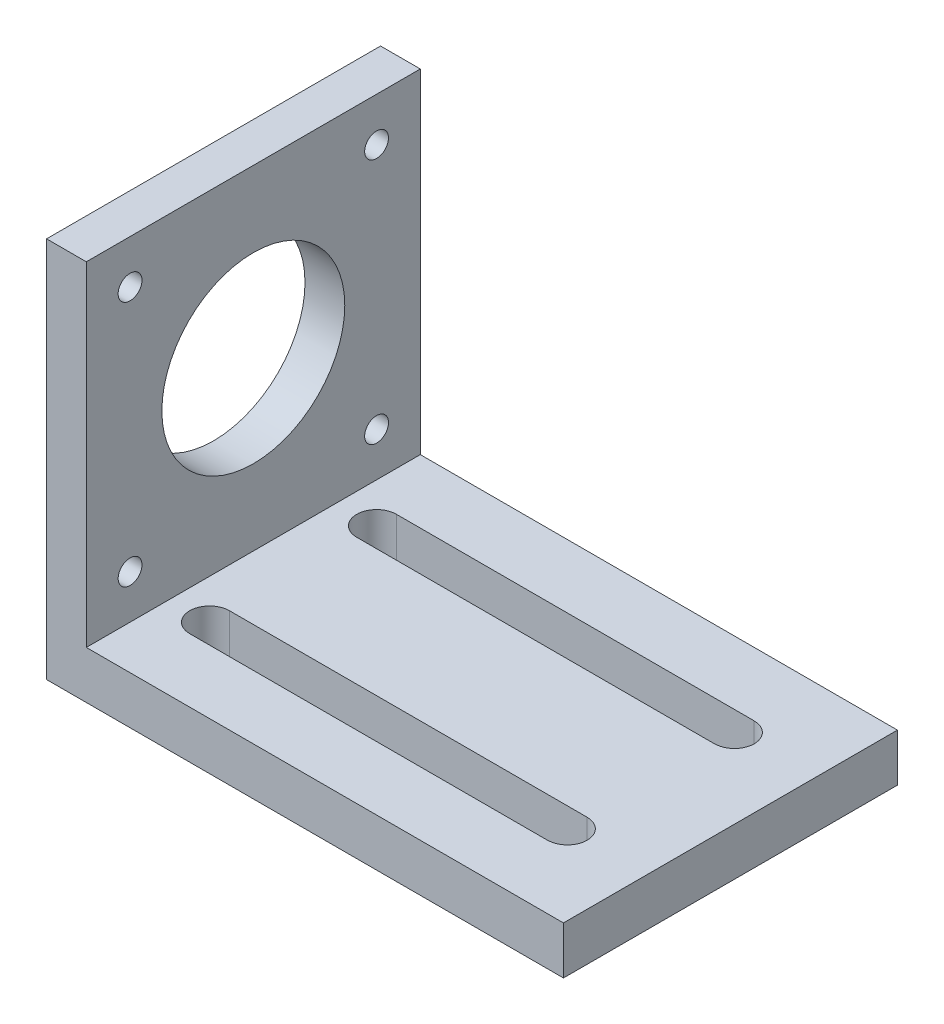
from build123d import *

# Parameters (mm, degrees)
SKETCH_1_W          = 42
SKETCH_1_H          = 42
SKETCH_1_R          = 1.5
EXTRUDE_1_DEPTH     = 5
SKETCH_2_W          = 42
SKETCH_2_H          = 6
EXTRUDE_2_DEPTH     = 65
CUT_EXTRUDE_2_DEPTH = 65
SKETCH_4_R          = 11.5
CUT_EXTRUDE_3_DEPTH = 10


with BuildPart() as part:
    # 草图1 → 凸台-拉伸1 (new body)
    with BuildSketch(Plane(origin=(0, 0, 0), x_dir=(0, 0, -1), z_dir=(1, 0, 0))):
        with Locations((-27.709265176, 0)):
            Rectangle(SKETCH_1_W, SKETCH_1_H)
        with Locations((-12.209265176, 15.5)):
            Circle(SKETCH_1_R, mode=Mode.SUBTRACT)
        with Locations((-43.209265176, 15.5)):
            Circle(SKETCH_1_R, mode=Mode.SUBTRACT)
        with Locations((-12.209265176, -15.5)):
            Circle(SKETCH_1_R, mode=Mode.SUBTRACT)
        with Locations((-43.209265176, -15.5)):
            Circle(SKETCH_1_R, mode=Mode.SUBTRACT)
    extrude(amount=EXTRUDE_1_DEPTH)

    # 草图2 → 凸台-拉伸2 (add)
    with BuildSketch(Plane.ZY):
        with Locations((27.709265176, -24)):
            Rectangle(SKETCH_2_W, SKETCH_2_H)
    extrude(amount=-EXTRUDE_2_DEPTH)

    # 草图3 → 切除-拉伸2 (cut)
    with BuildSketch(Plane(origin=(0, -27, 0), x_dir=(-1, 0, 0), z_dir=(0, -1, 0))):
        with BuildLine():
            ThreePointArc((-55, -35.722195546), (-57.48706963, -38.209265176), (-55, -40.696334806))
            Line((-55, -40.696334806), (-55, -35.722195546))
        make_face()
        with BuildLine():
            Line((-55, -35.722195546), (-55, -40.696334806))
            ThreePointArc((-55, -40.696334806), (-53.241376199, -39.967888976), (-52.51293037, -38.209265176))
            ThreePointArc((-52.51293037, -38.209265176), (-53.241376199, -36.450641375), (-55, -35.722195546))
        make_face()
        with BuildLine():
            Line((-55, -40.709265176), (-10, -40.709265176))
            ThreePointArc((-10, -40.709265176), (-12.5, -38.209265176), (-10, -35.709265176))
            Line((-10, -35.709265176), (-55, -35.709265176))
            Line((-55, -35.709265176), (-55, -35.722195546))
            ThreePointArc((-55, -35.722195546), (-53.241376199, -36.450641375), (-52.51293037, -38.209265176))
            ThreePointArc((-52.51293037, -38.209265176), (-53.241376199, -39.967888976), (-55, -40.696334806))
            Line((-55, -40.696334806), (-55, -40.709265176))
        make_face()
        with BuildLine():
            ThreePointArc((-10, -35.709265176), (-12.5, -38.209265176), (-10, -40.709265176))
            Line((-10, -40.709265176), (-10, -35.709265176))
        make_face()
        with BuildLine():
            Line((-10, -35.709265176), (-10, -40.709265176))
            ThreePointArc((-10, -40.709265176), (-8.232233047, -39.977032129), (-7.5, -38.209265176))
            ThreePointArc((-7.5, -38.209265176), (-8.232233047, -36.441498223), (-10, -35.709265176))
        make_face()
        with BuildLine():
            ThreePointArc((-10, -14.709265176), (-12.5, -17.209265176), (-10, -19.709265176))
            Line((-10, -19.709265176), (-10, -14.709265176))
        make_face()
        with BuildLine():
            Line((-10, -14.709265176), (-10, -19.709265176))
            ThreePointArc((-10, -19.709265176), (-8.232233047, -18.977032129), (-7.5, -17.209265176))
            ThreePointArc((-7.5, -17.209265176), (-8.232233047, -15.441498223), (-10, -14.709265176))
        make_face()
        with BuildLine():
            Line((-55, -19.709265176), (-10, -19.709265176))
            ThreePointArc((-10, -19.709265176), (-12.5, -17.209265176), (-10, -14.709265176))
            Line((-10, -14.709265176), (-55, -14.709265176))
            Line((-55, -14.709265176), (-55, -14.722195546))
            ThreePointArc((-55, -14.722195546), (-53.241376199, -15.450641375), (-52.51293037, -17.209265176))
            ThreePointArc((-52.51293037, -17.209265176), (-53.241376199, -18.967888976), (-55, -19.696334806))
            Line((-55, -19.696334806), (-55, -19.709265176))
        make_face()
        with BuildLine():
            ThreePointArc((-55, -14.722195546), (-57.48706963, -17.209265176), (-55, -19.696334806))
            Line((-55, -19.696334806), (-55, -14.722195546))
        make_face()
        with BuildLine():
            Line((-55, -14.722195546), (-55, -19.696334806))
            ThreePointArc((-55, -19.696334806), (-53.241376199, -18.967888976), (-52.51293037, -17.209265176))
            ThreePointArc((-52.51293037, -17.209265176), (-53.241376199, -15.450641375), (-55, -14.722195546))
        make_face()
    extrude(amount=-CUT_EXTRUDE_2_DEPTH, mode=Mode.SUBTRACT)

    # 草图4 → 切除-拉伸3 (cut)
    with BuildSketch(Plane(origin=(5, 0, 0), x_dir=(0, 0, -1), z_dir=(1, 0, 0))):
        with Locations((-27.709265176, 0)):
            Circle(SKETCH_4_R)
    extrude(amount=-CUT_EXTRUDE_3_DEPTH, mode=Mode.SUBTRACT)


solid = part.part
